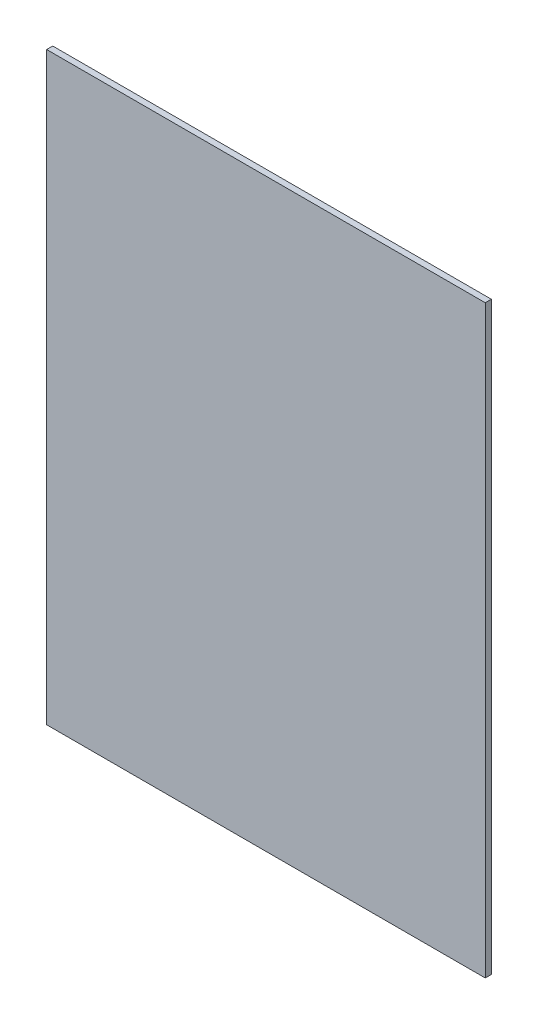
from build123d import *

# Parameters (mm, degrees)
SKETCH1_W           = 228.6
SKETCH1_H           = 304.8
BOSS_EXTRUDE1_DEPTH = 3.175


with BuildPart() as part:
    # Sketch1 → Boss-Extrude1 (new body)
    with BuildSketch(Plane.XY):
        Rectangle(SKETCH1_W, SKETCH1_H)
    extrude(amount=BOSS_EXTRUDE1_DEPTH)


solid = part.part
